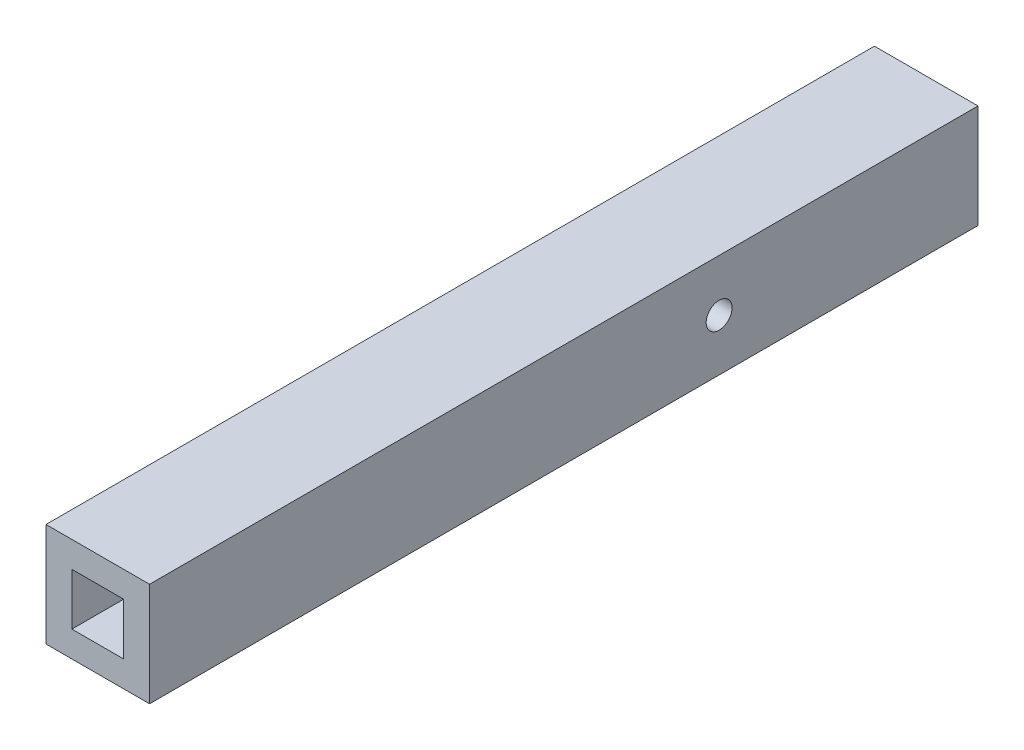
from build123d import *

# Parameters (mm, degrees)
SKETCH1_W           = 25.4
SKETCH1_H           = 25.4
BOSS_EXTRUDE1_DEPTH = 203.2
SKETCH2_R           = 3.175
CUT_EXTRUDE1_DEPTH  = 207.350575478
SKETCH3_W           = 12.7
SKETCH3_H           = 12.7
CUT_EXTRUDE2_DEPTH  = 207.350575478


with BuildPart() as part:
    # Sketch1 → Boss-Extrude1 (new body)
    with BuildSketch(Plane.XY):
        with Locations((-12.7, 12.7)):
            Rectangle(SKETCH1_W, SKETCH1_H)
    extrude(amount=BOSS_EXTRUDE1_DEPTH)

    # Sketch2 → Cut-Extrude1 (cut, through all)
    with BuildSketch(Plane(origin=(0, 0, 0), x_dir=(0, 0, -1), z_dir=(1, 0, 0))):
        with Locations(Location((-63.5, 12.7, 0), (0, 0, 90))):
            Circle(SKETCH2_R)
    extrude(amount=-CUT_EXTRUDE1_DEPTH, mode=Mode.SUBTRACT)

    # Sketch3 → Cut-Extrude2 (cut, through all)
    with BuildSketch(Plane(origin=(0, 0, 0), x_dir=(-1, 0, 0), z_dir=(0, 0, -1))):
        with Locations((12.7, 12.7)):
            Rectangle(SKETCH3_W, SKETCH3_H)
    extrude(amount=-CUT_EXTRUDE2_DEPTH, mode=Mode.SUBTRACT)


solid = part.part
